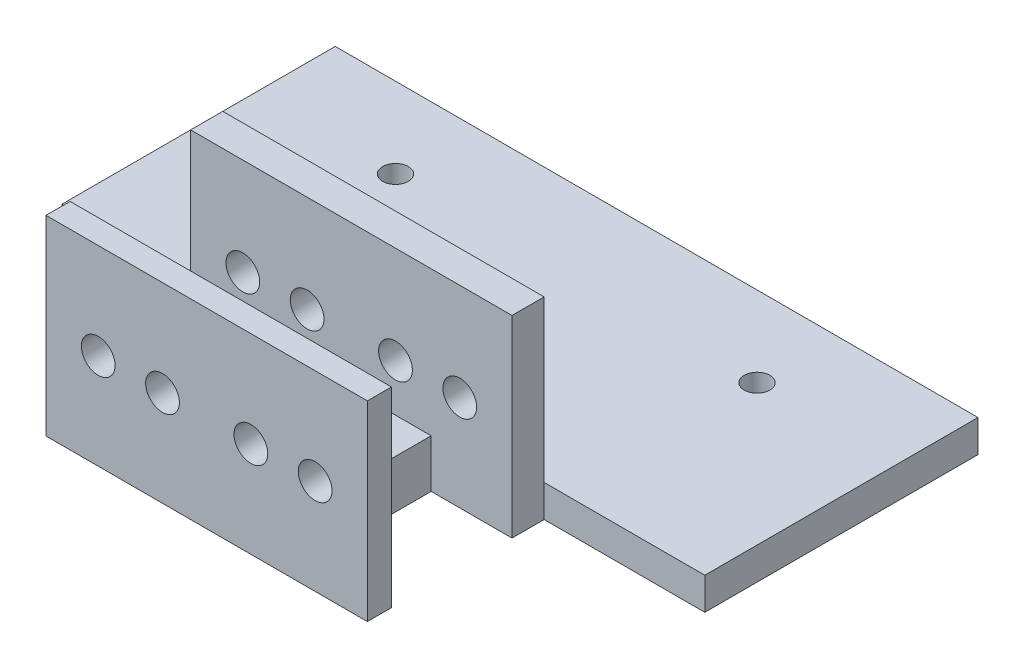
from build123d import *

# Parameters (mm, degrees)
SKETCH_1_W          = 80
SKETCH_1_H          = 34
EXTRUDE_1_DEPTH     = 4
CUT_EXTRUDE_1_REACH = 45.646
SKETCH_2_R          = 1.6
SKETCH_3_W          = 40
SKETCH_3_H          = 24
EXTRUDE_2_DEPTH     = 4
SKETCH_4_W          = 20
SKETCH_4_H          = 6
EXTRUDE_3_DEPTH     = 15
SKETCH_5_W          = 40
SKETCH_5_H          = 23.790626796
EXTRUDE_4_DEPTH     = 3
CUT_EXTRUDE_2_REACH = 74.883
SKETCH_6_R          = 2.1


with BuildPart() as part:
    # 草图1 → 凸台-拉伸1 (new body)
    with BuildSketch(Plane(origin=(0, 0, 0), x_dir=(1, 0, 0), z_dir=(0, 1, 0))):
        Rectangle(SKETCH_1_W, SKETCH_1_H)
    extrude(amount=EXTRUDE_1_DEPTH)

    # 草图2 → 切除-拉伸1 (cut, up to next)
    with BuildSketch(Plane(origin=(0, 4, 0), x_dir=(1, 0, 0), z_dir=(0, 1, 0)), mode=Mode.PRIVATE) as cut_extrude_1_sk1:
        with Locations(Location((-22.5, 7, 0), (0, 0, 270))):
            Circle(SKETCH_2_R)
    cut_extrude_1_tool1 = extrude(cut_extrude_1_sk1.sketch, amount=-CUT_EXTRUDE_1_REACH, mode=Mode.PRIVATE) & part.part
    # 草图2 → 切除-拉伸1 (cut, up to next)
    with BuildSketch(Plane(origin=(0, 4, 0), x_dir=(1, 0, 0), z_dir=(0, 1, 0)), mode=Mode.PRIVATE) as cut_extrude_1_sk2:
        with Locations(Location((22.5, 7, 0), (0, 0, 270))):
            Circle(SKETCH_2_R)
    cut_extrude_1_tool2 = extrude(cut_extrude_1_sk2.sketch, amount=-CUT_EXTRUDE_1_REACH, mode=Mode.PRIVATE) & part.part
    add(cut_extrude_1_tool1.solids().sort_by_distance((-22.5, 4, -7))[0], mode=Mode.SUBTRACT)
    add(cut_extrude_1_tool2.solids().sort_by_distance((22.5, 4, -7))[0], mode=Mode.SUBTRACT)

    # 草图3 → 凸台-拉伸2 (add)
    with BuildSketch(Plane.XY.offset(17)):
        with Locations((0, 12)):
            Rectangle(SKETCH_3_W, SKETCH_3_H)
    extrude(amount=EXTRUDE_2_DEPTH)

    # 草图4 → 凸台-拉伸3 (add)
    with BuildSketch(Plane.XY.offset(21)):
        with Locations((-0.061987537, 3)):
            Rectangle(SKETCH_4_W, SKETCH_4_H)
    extrude(amount=EXTRUDE_3_DEPTH)

    # 草图5 → 凸台-拉伸4 (add)
    with BuildSketch(Plane.XY.offset(36)):
        with Locations((0, 11.895313398)):
            Rectangle(SKETCH_5_W, SKETCH_5_H)
    extrude(amount=EXTRUDE_4_DEPTH)

    # 切除-拉伸2: up to this face of the body (flat: up to its plane)
    cut_extrude_2_end = Plane(part.part.faces().sort_by_distance((0, 14, 17))[0])
    # 草图6 → 切除-拉伸2 (cut, up to the picked face)
    with BuildSketch(Plane.XY.offset(39), mode=Mode.PRIVATE) as cut_extrude_2_sk1:
        with Locations((-13.5, 11.895313398)):
            Circle(SKETCH_6_R)
    cut_extrude_2_tool1 = split(extrude(cut_extrude_2_sk1.sketch, amount=-CUT_EXTRUDE_2_REACH, mode=Mode.PRIVATE), bisect_by=cut_extrude_2_end, keep=Keep.BOTH, mode=Mode.PRIVATE)
    # 草图6 → 切除-拉伸2 (cut, up to the picked face)
    with BuildSketch(Plane.XY.offset(39), mode=Mode.PRIVATE) as cut_extrude_2_sk2:
        with Locations((-5.5, 11.895313398)):
            Circle(SKETCH_6_R)
    cut_extrude_2_tool2 = split(extrude(cut_extrude_2_sk2.sketch, amount=-CUT_EXTRUDE_2_REACH, mode=Mode.PRIVATE), bisect_by=cut_extrude_2_end, keep=Keep.BOTH, mode=Mode.PRIVATE)
    # 草图6 → 切除-拉伸2 (cut, up to the picked face)
    with BuildSketch(Plane.XY.offset(39), mode=Mode.PRIVATE) as cut_extrude_2_sk3:
        with Locations((5.5, 11.895313398)):
            Circle(SKETCH_6_R)
    cut_extrude_2_tool3 = split(extrude(cut_extrude_2_sk3.sketch, amount=-CUT_EXTRUDE_2_REACH, mode=Mode.PRIVATE), bisect_by=cut_extrude_2_end, keep=Keep.BOTH, mode=Mode.PRIVATE)
    # 草图6 → 切除-拉伸2 (cut, up to the picked face)
    with BuildSketch(Plane.XY.offset(39), mode=Mode.PRIVATE) as cut_extrude_2_sk4:
        with Locations((13.5, 11.895313398)):
            Circle(SKETCH_6_R)
    cut_extrude_2_tool4 = split(extrude(cut_extrude_2_sk4.sketch, amount=-CUT_EXTRUDE_2_REACH, mode=Mode.PRIVATE), bisect_by=cut_extrude_2_end, keep=Keep.BOTH, mode=Mode.PRIVATE)
    add(cut_extrude_2_tool1.solids().sort_by(Axis((-13.5, 11.895313, 39), (0, 0, -1)))[0], mode=Mode.SUBTRACT)
    add(cut_extrude_2_tool2.solids().sort_by(Axis((-5.5, 11.895313, 39), (0, 0, -1)))[0], mode=Mode.SUBTRACT)
    add(cut_extrude_2_tool3.solids().sort_by(Axis((5.5, 11.895313, 39), (0, 0, -1)))[0], mode=Mode.SUBTRACT)
    add(cut_extrude_2_tool4.solids().sort_by(Axis((13.5, 11.895313, 39), (0, 0, -1)))[0], mode=Mode.SUBTRACT)


solid = part.part
